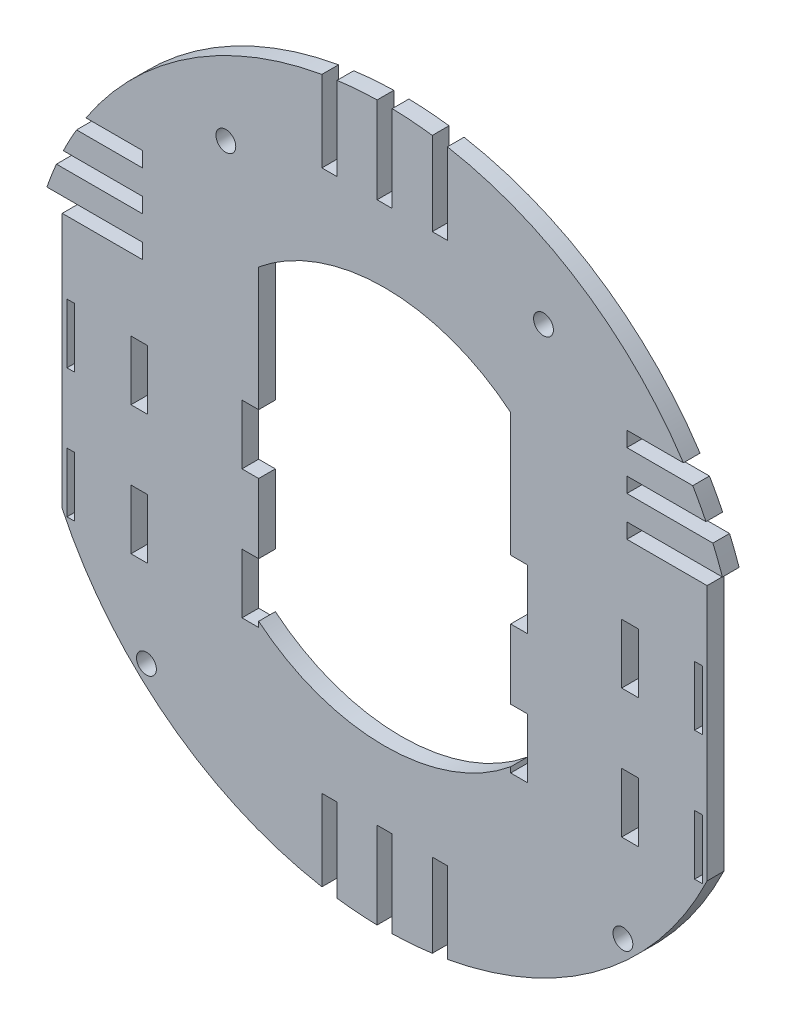
from build123d import *

# Parameters (mm, degrees)
SKETCH1_R           = 114.3
BOSS_EXTRUDE1_DEPTH = 5.334
TOPBOTTOMCUTS_DEPTH = 162.732592745
SIDECUTS_DEPTH      = 162.714591138
SKETCH4_W           = 2.4638
SKETCH4_H           = 19.05
SKETCH4_W_2         = 5.334
MOTORMOUNTS_DEPTH   = 162.714591138
SKETCH5_R           = 3.175
BOLTHOLES_DEPTH     = 162.714591138
SKETCH6_W           = 22.352
SKETCH6_H           = 83.470360746
WHEEL_CUTOUTS_DEPTH = 162.714591138


with BuildPart() as part:
    # Sketch1 → Boss-Extrude1 (new body)
    with BuildSketch(Plane.XY):
        Circle(SKETCH1_R)
        with BuildLine():
            Line((-40.299999918, 49.073006904), (-40.299999918, -49.073006904))
            ThreePointArc((-40.299999918, -49.073006904), (0, -63.5), (40.299999918, -49.073006904))
            Line((40.299999918, -49.073006904), (40.299999918, 49.073006904))
            ThreePointArc((40.299999918, 49.073006904), (0, 63.5), (-40.299999918, 49.073006904))
        make_face(mode=Mode.SUBTRACT)
    extrude(amount=BOSS_EXTRUDE1_DEPTH)

    # Sketch2 → TopBottomCuts (cut, through all)
    with BuildSketch(Plane.XY.offset(5.334)):
        Polygon((-20.066, 92.964), (-20.066, 116.329451538), (-15.24, 116.329451538), (-15.24, 92.964), (-15.24, 86.614), (-20.066, 86.614), align=None)
        Polygon((15.24, 92.964), (15.24, 86.614), (20.066, 86.614), (20.066, 92.964), (20.066, 116.329451538), (15.24, 116.329451538), align=None)
        Polygon((-2.413, 92.964), (-2.413, 86.614), (2.413, 86.614), (2.413, 92.964), (2.413, 116.329451538), (-2.413, 116.329451538), align=None)
        Polygon((20.066, -116.329451538), (20.066, -92.964), (20.066, -86.614), (15.24, -86.614), (15.24, -92.964), (15.24, -116.329451538), align=None)
        Polygon((2.413, -116.329451538), (2.413, -92.964), (2.413, -86.614), (-2.413, -86.614), (-2.413, -92.964), (-2.413, -116.329451538), align=None)
        Polygon((-15.24, -116.329451538), (-15.24, -92.964), (-15.24, -86.614), (-20.066, -86.614), (-20.066, -92.964), (-20.066, -116.329451538), align=None)
    extrude(amount=-TOPBOTTOMCUTS_DEPTH, mode=Mode.SUBTRACT)

    # Sketch3 → SideCuts (cut, through all)
    with BuildSketch(Plane.XY.offset(5.334)):
        Polygon((-83.82, 37.338), (-77.47, 37.338), (-77.47, 32.512), (-83.82, 32.512), (-110.947890819, 32.512), (-110.947890819, 37.338), align=None)
        Polygon((-83.82, 62.738), (-104.163602824, 62.738), (-104.163602824, 57.912), (-83.82, 57.912), (-77.47, 57.912), (-77.47, 62.738), align=None)
        Polygon((-83.82, 50.038), (-77.47, 50.038), (-77.47, 45.212), (-83.82, 45.212), (-108.296559878, 45.212), (-108.296559878, 50.038), align=None)
        Polygon((110.947890819, 32.512), (83.82, 32.512), (77.47, 32.512), (77.47, 37.338), (83.82, 37.338), (110.947890819, 37.338), align=None)
        Polygon((108.296559878, 45.212), (83.82, 45.212), (77.47, 45.212), (77.47, 50.038), (83.82, 50.038), (108.296559878, 50.038), align=None)
        Polygon((77.47, 62.738), (77.47, 57.912), (83.82, 57.912), (104.163602824, 57.912), (104.163602824, 62.738), (83.82, 62.738), align=None)
    extrude(amount=-SIDECUTS_DEPTH, mode=Mode.SUBTRACT)

    # Sketch4 → MotorMounts (cut, through all)
    with BuildSketch(Plane.XY.offset(5.334)):
        with Locations((-100.3681, -41.275)):
            Rectangle(SKETCH4_W, SKETCH4_H)
        with Locations((-100.3681, 0)):
            Rectangle(SKETCH4_W, SKETCH4_H)
        with Locations((-78.469199932, 0)):
            Rectangle(SKETCH4_W_2, SKETCH4_H)
        with Locations((-42.966999918, 0)):
            Rectangle(SKETCH4_W_2, SKETCH4_H)
        with Locations((-78.469199932, -41.275)):
            Rectangle(SKETCH4_W_2, SKETCH4_H)
        with Locations((-42.966999918, -41.275)):
            Rectangle(SKETCH4_W_2, SKETCH4_H)
        with Locations((42.966999918, -41.275)):
            Rectangle(SKETCH4_W_2, SKETCH4_H)
        with Locations((78.469199932, -41.275)):
            Rectangle(SKETCH4_W_2, SKETCH4_H)
        with Locations((100.3681, -41.275)):
            Rectangle(SKETCH4_W, SKETCH4_H)
        with Locations((42.966999918, 0)):
            Rectangle(SKETCH4_W_2, SKETCH4_H)
        with Locations((78.469199932, 0)):
            Rectangle(SKETCH4_W_2, SKETCH4_H)
        with Locations((100.3681, 0)):
            Rectangle(SKETCH4_W, SKETCH4_H)
    extrude(amount=-MOTORMOUNTS_DEPTH, mode=Mode.SUBTRACT)

    # Sketch5 → BoltHoles (cut, through all)
    with BuildSketch(Plane.XY.offset(5.334)):
        with Locations((-76.2, -78.74)):
            Circle(SKETCH5_R)
        with Locations((-50.8, 78.74)):
            Circle(SKETCH5_R)
        with Locations(Location((76.2, -78.74, 0), (0, 0, 180))):
            Circle(SKETCH5_R)
        with Locations(Location((50.8, 78.74, 0), (0, 0, 180))):
            Circle(SKETCH5_R)
    extrude(amount=-BOLTHOLES_DEPTH, mode=Mode.SUBTRACT)

    # Sketch6 → Wheel Cutouts (cut, through all)
    with BuildSketch(Plane.XY.offset(5.334)):
        with Locations((-114.3, -7.559146116)):
            Rectangle(SKETCH6_W, SKETCH6_H)
        with Locations((114.3, -7.559146116)):
            Rectangle(SKETCH6_W, SKETCH6_H)
    extrude(amount=-WHEEL_CUTOUTS_DEPTH, mode=Mode.SUBTRACT)


solid = part.part
